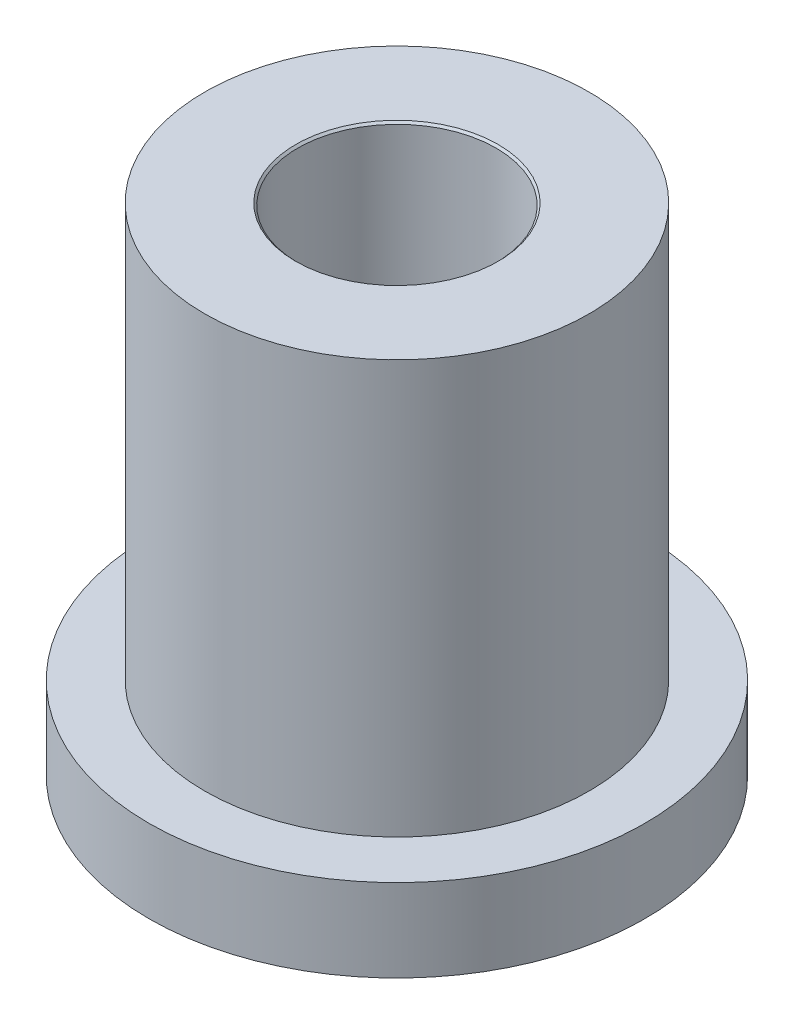
from build123d import *

# Parameters (mm, degrees)
SKETCH1_R                      = 3
BOSS_EXTRUDE1_DEPTH            = 1
SKETCH2_R                      = 2.325
BOSS_EXTRUDE2_DEPTH            = 5
M2_CLEARANCE_HOLE1_D           = 2.4
M2_CLEARANCE_HOLE1_CSINK_D     = 2.45
M2_CLEARANCE_HOLE1_CSINK_ANGLE = 90


with BuildPart() as part:
    # Sketch1 → Boss-Extrude1 (new body)
    with BuildSketch(Plane(origin=(0, 0, 0), x_dir=(1, 0, 0), z_dir=(0, 1, 0))):
        with Locations(Location((0, 0, 0), (0, 0, 270))):
            Circle(SKETCH1_R)
    extrude(amount=BOSS_EXTRUDE1_DEPTH)

    # Sketch2 → Boss-Extrude2 (add)
    with BuildSketch(Plane(origin=(0, 1, 0), x_dir=(1, 0, 0), z_dir=(0, 1, 0))):
        with Locations(Location((0, 0, 0), (0, 0, 270))):
            Circle(SKETCH2_R)
    extrude(amount=BOSS_EXTRUDE2_DEPTH)

    # M2 Clearance Hole1 (through all)
    with Locations(Plane(origin=(0, 6, 0), x_dir=(1, 0, 0), z_dir=(0, 1, 0))):
        with Locations((0, 0)):
            CounterSinkHole(M2_CLEARANCE_HOLE1_D / 2, M2_CLEARANCE_HOLE1_CSINK_D / 2, counter_sink_angle=M2_CLEARANCE_HOLE1_CSINK_ANGLE)


solid = part.part
